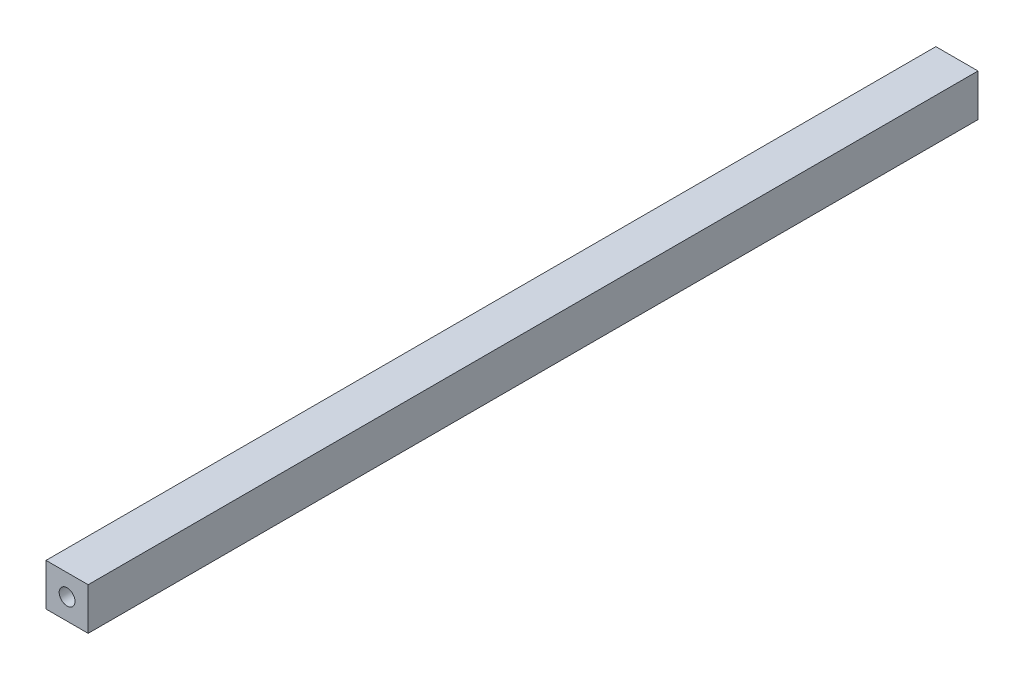
from build123d import *

# Parameters (mm, degrees)
SKETCH1_W                        = 25.4
SKETCH1_H                        = 25.4
BOSS_EXTRUDE1_DEPTH              = 536.194
F_3_8_0_375_DIAMETER_HOLE1_D     = 9.525
F_3_8_0_375_DIAMETER_HOLE1_DEPTH = 25.4
F_3_8_0_375_DIAMETER_HOLE1_TIP   = 2.861598698
F_3_8_0_375_DIAMETER_HOLE2_D     = 9.525
F_3_8_0_375_DIAMETER_HOLE2_DEPTH = 25.4
F_3_8_0_375_DIAMETER_HOLE2_TIP   = 2.861598698


with BuildPart() as part:
    # Sketch1 → Boss-Extrude1 (new body)
    with BuildSketch(Plane.XY):
        with Locations((12.7, 12.7)):
            Rectangle(SKETCH1_W, SKETCH1_H)
    extrude(amount=BOSS_EXTRUDE1_DEPTH)

    # 3/8 (0.375) Diameter Hole1
    with Locations(Plane(origin=(0, 0, 0), x_dir=(-1, 0, 0), z_dir=(0, 0, -1))):
        with Locations((-12.7, 12.7)):
            Hole(F_3_8_0_375_DIAMETER_HOLE1_D / 2, depth=F_3_8_0_375_DIAMETER_HOLE1_DEPTH)
            with Locations((0, 0, -(F_3_8_0_375_DIAMETER_HOLE1_DEPTH + F_3_8_0_375_DIAMETER_HOLE1_TIP / 2))):  # 118° drill point
                Cone(0, F_3_8_0_375_DIAMETER_HOLE1_D / 2, F_3_8_0_375_DIAMETER_HOLE1_TIP, mode=Mode.SUBTRACT)

    # 3/8 (0.375) Diameter Hole2
    with Locations(Plane.XY.offset(536.194)):
        with Locations((12.7, 12.7)):
            Hole(F_3_8_0_375_DIAMETER_HOLE2_D / 2, depth=F_3_8_0_375_DIAMETER_HOLE2_DEPTH)
            with Locations((0, 0, -(F_3_8_0_375_DIAMETER_HOLE2_DEPTH + F_3_8_0_375_DIAMETER_HOLE2_TIP / 2))):  # 118° drill point
                Cone(0, F_3_8_0_375_DIAMETER_HOLE2_D / 2, F_3_8_0_375_DIAMETER_HOLE2_TIP, mode=Mode.SUBTRACT)


solid = part.part
